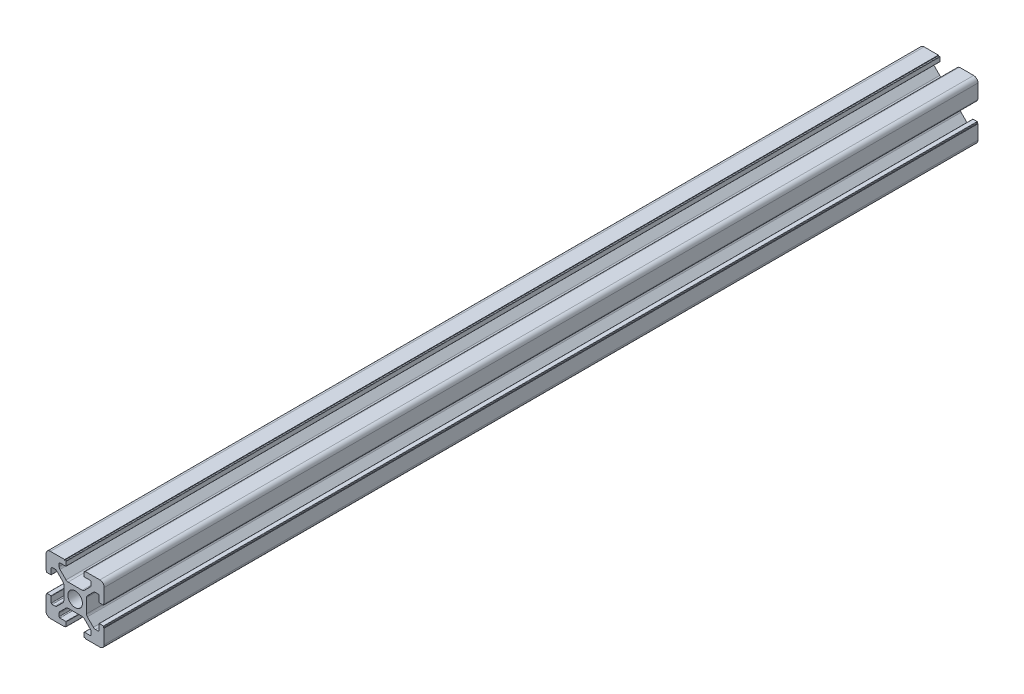
from build123d import *

# Parameters (mm, degrees)
SKETCH_1_R      = 2.5
EXTRUDE_1_DEPTH = 300
FILLET_1_R      = 1.5


with BuildPart() as part:
    # 草图1 → 凸台-拉伸1 (new body)
    with BuildSketch(Plane.XY):
        with BuildLine():
            Line((20, 13.6), (20, 20))
            Line((20, 20), (13.6, 20))
            Line((13.6, 20), (13.6, 19.8))
            Line((13.6, 19.8), (13.2, 19.8))
            ThreePointArc((13.2, 19.8), (13.129289322, 19.770710678), (13.1, 19.7))
            Line((13.1, 19.7), (13.1, 18.3))
            ThreePointArc((13.1, 18.3), (13.129289322, 18.229289322), (13.2, 18.2))
            Line((13.2, 18.2), (15.2, 18.2))
            ThreePointArc((15.2, 18.2), (15.412132034, 18.112132034), (15.5, 17.9))
            Line((15.5, 17.9), (15.5, 16.974873734))
            ThreePointArc((15.5, 16.974873734), (15.423879533, 16.592190302), (15.207106781, 16.267766953))
            Line((15.207106781, 16.267766953), (13.132233047, 14.192893219))
            ThreePointArc((13.132233047, 14.192893219), (12.807809698, 13.976120467), (12.425126266, 13.9))
            Line((12.425126266, 13.9), (7.574873734, 13.9))
            ThreePointArc((7.574873734, 13.9), (7.192190302, 13.976120467), (6.867766953, 14.192893219))
            Line((6.867766953, 14.192893219), (4.792893219, 16.267766953))
            ThreePointArc((4.792893219, 16.267766953), (4.576120467, 16.592190302), (4.5, 16.974873734))
            Line((4.5, 16.974873734), (4.5, 17.9))
            ThreePointArc((4.5, 17.9), (4.587867966, 18.112132034), (4.8, 18.2))
            Line((4.8, 18.2), (6.8, 18.2))
            ThreePointArc((6.8, 18.2), (6.870710678, 18.229289322), (6.9, 18.3))
            Line((6.9, 18.3), (6.9, 19.7))
            ThreePointArc((6.9, 19.7), (6.870710678, 19.770710678), (6.8, 19.8))
            Line((6.8, 19.8), (6.4, 19.8))
            Line((6.4, 19.8), (6.4, 20))
            Line((6.4, 20), (0, 20))
            Line((0, 20), (0, 13.6))
            Line((0, 13.6), (0.2, 13.6))
            Line((0.2, 13.6), (0.2, 13.2))
            ThreePointArc((0.2, 13.2), (0.229289322, 13.129289322), (0.3, 13.1))
            Line((0.3, 13.1), (1.7, 13.1))
            ThreePointArc((1.7, 13.1), (1.770710678, 13.129289322), (1.8, 13.2))
            Line((1.8, 13.2), (1.8, 15.2))
            ThreePointArc((1.8, 15.2), (1.887867966, 15.412132034), (2.1, 15.5))
            Line((2.1, 15.5), (3.025126266, 15.5))
            ThreePointArc((3.025126266, 15.5), (3.407809698, 15.423879533), (3.732233047, 15.207106781))
            Line((3.732233047, 15.207106781), (5.807106781, 13.132233047))
            ThreePointArc((5.807106781, 13.132233047), (6.023879533, 12.807809698), (6.1, 12.425126266))
            Line((6.1, 12.425126266), (6.1, 7.574873734))
            ThreePointArc((6.1, 7.574873734), (6.023879533, 7.192190302), (5.807106781, 6.867766953))
            Line((5.807106781, 6.867766953), (3.732233047, 4.792893219))
            ThreePointArc((3.732233047, 4.792893219), (3.407809698, 4.576120467), (3.025126266, 4.5))
            Line((3.025126266, 4.5), (2.1, 4.5))
            ThreePointArc((2.1, 4.5), (1.887867966, 4.587867966), (1.8, 4.8))
            Line((1.8, 4.8), (1.8, 6.8))
            ThreePointArc((1.8, 6.8), (1.770710678, 6.870710678), (1.7, 6.9))
            Line((1.7, 6.9), (0.3, 6.9))
            ThreePointArc((0.3, 6.9), (0.229289322, 6.870710678), (0.2, 6.8))
            Line((0.2, 6.8), (0.2, 6.4))
            Line((0.2, 6.4), (0, 6.4))
            Line((0, 6.4), (0, 0))
            Line((0, 0), (6.4, 0))
            Line((6.4, 0), (6.4, 0.2))
            Line((6.4, 0.2), (6.8, 0.2))
            ThreePointArc((6.8, 0.2), (6.870710678, 0.229289322), (6.9, 0.3))
            Line((6.9, 0.3), (6.9, 1.7))
            ThreePointArc((6.9, 1.7), (6.870710678, 1.770710678), (6.8, 1.8))
            Line((6.8, 1.8), (4.8, 1.8))
            ThreePointArc((4.8, 1.8), (4.587867966, 1.887867966), (4.5, 2.1))
            Line((4.5, 2.1), (4.5, 3.025126266))
            ThreePointArc((4.5, 3.025126266), (4.576120467, 3.407809698), (4.792893219, 3.732233047))
            Line((4.792893219, 3.732233047), (6.867766953, 5.807106781))
            ThreePointArc((6.867766953, 5.807106781), (7.192190302, 6.023879533), (7.574873734, 6.1))
            Line((7.574873734, 6.1), (12.425126266, 6.1))
            ThreePointArc((12.425126266, 6.1), (12.807809698, 6.023879533), (13.132233047, 5.807106781))
            Line((13.132233047, 5.807106781), (15.207106781, 3.732233047))
            ThreePointArc((15.207106781, 3.732233047), (15.423879533, 3.407809698), (15.5, 3.025126266))
            Line((15.5, 3.025126266), (15.5, 2.1))
            ThreePointArc((15.5, 2.1), (15.412132034, 1.887867966), (15.2, 1.8))
            Line((15.2, 1.8), (13.2, 1.8))
            ThreePointArc((13.2, 1.8), (13.129289322, 1.770710678), (13.1, 1.7))
            Line((13.1, 1.7), (13.1, 0.3))
            ThreePointArc((13.1, 0.3), (13.129289322, 0.229289322), (13.2, 0.2))
            Line((13.2, 0.2), (13.6, 0.2))
            Line((13.6, 0.2), (13.6, 0))
            Line((13.6, 0), (20, 0))
            Line((20, 0), (20, 6.4))
            Line((20, 6.4), (19.8, 6.4))
            Line((19.8, 6.4), (19.8, 6.8))
            ThreePointArc((19.8, 6.8), (19.770710678, 6.870710678), (19.7, 6.9))
            Line((19.7, 6.9), (18.3, 6.9))
            ThreePointArc((18.3, 6.9), (18.229289322, 6.870710678), (18.2, 6.8))
            Line((18.2, 6.8), (18.2, 4.8))
            ThreePointArc((18.2, 4.8), (18.112132034, 4.587867966), (17.9, 4.5))
            Line((17.9, 4.5), (16.974873734, 4.5))
            ThreePointArc((16.974873734, 4.5), (16.592190302, 4.576120467), (16.267766953, 4.792893219))
            Line((16.267766953, 4.792893219), (14.192893219, 6.867766953))
            ThreePointArc((14.192893219, 6.867766953), (13.976120467, 7.192190302), (13.9, 7.574873734))
            Line((13.9, 7.574873734), (13.9, 12.425126266))
            ThreePointArc((13.9, 12.425126266), (13.976120467, 12.807809698), (14.192893219, 13.132233047))
            Line((14.192893219, 13.132233047), (16.267766953, 15.207106781))
            ThreePointArc((16.267766953, 15.207106781), (16.592190302, 15.423879533), (16.974873734, 15.5))
            Line((16.974873734, 15.5), (17.9, 15.5))
            ThreePointArc((17.9, 15.5), (18.112132034, 15.412132034), (18.2, 15.2))
            Line((18.2, 15.2), (18.2, 13.2))
            ThreePointArc((18.2, 13.2), (18.229289322, 13.129289322), (18.3, 13.1))
            Line((18.3, 13.1), (19.7, 13.1))
            ThreePointArc((19.7, 13.1), (19.770710678, 13.129289322), (19.8, 13.2))
            Line((19.8, 13.2), (19.8, 13.6))
            Line((19.8, 13.6), (20, 13.6))
        make_face()
        with Locations((10, 10)):
            Circle(SKETCH_1_R, mode=Mode.SUBTRACT)
    extrude(amount=EXTRUDE_1_DEPTH)

    # 圆角1
    fillet_1_edges = [part.edges().sort_by_distance(p)[0] for p in [
        (0, 0, 150),
        (0, 20, 150),
        (20, 20, 150),
        (20, 0, 150),
    ]]
    fillet(fillet_1_edges, radius=FILLET_1_R)


solid = part.part
